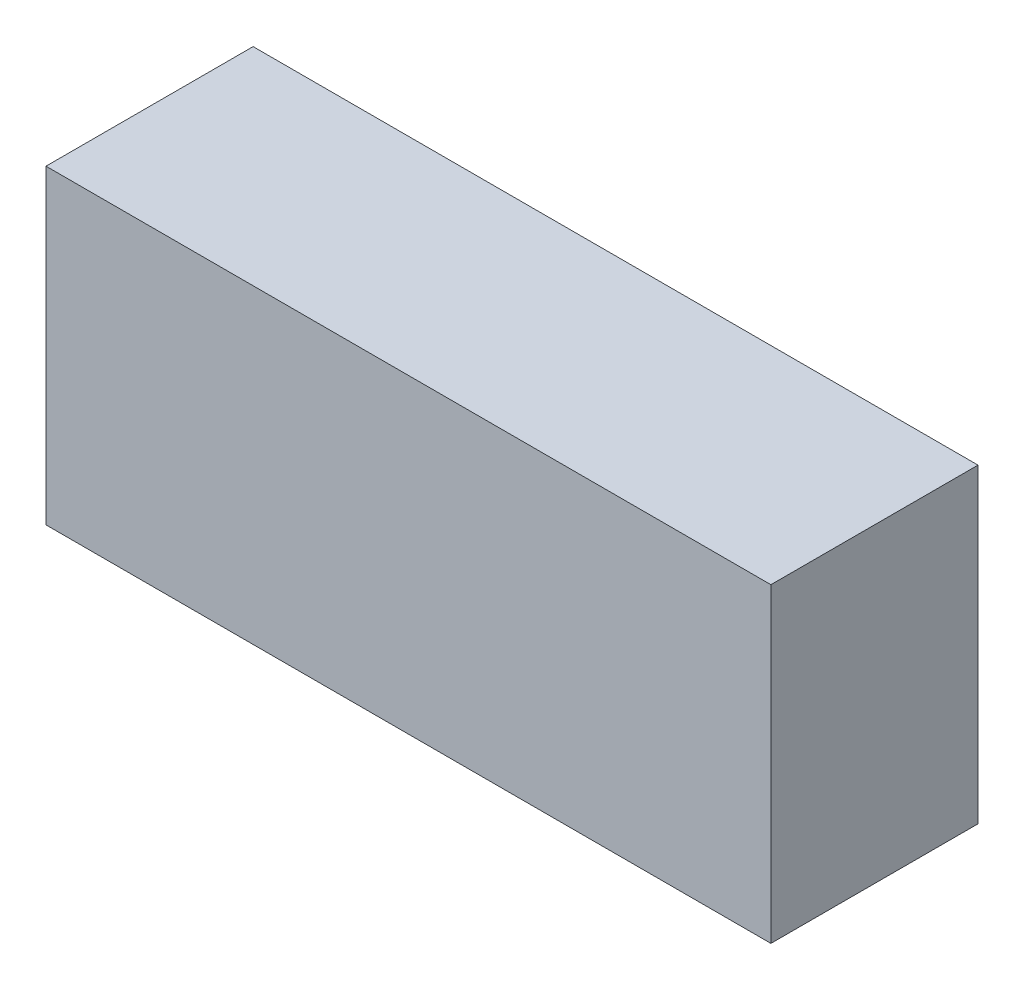
from build123d import *

# Parameters (mm, degrees)
SKETCH1_W           = 177.8
SKETCH1_H           = 76.2
BOSS_EXTRUDE1_DEPTH = 50.8


with BuildPart() as part:
    # Sketch1 → Boss-Extrude1 (new body)
    with BuildSketch(Plane.XY):
        with Locations((88.9, 38.1)):
            Rectangle(SKETCH1_W, SKETCH1_H)
    extrude(amount=BOSS_EXTRUDE1_DEPTH)


solid = part.part
